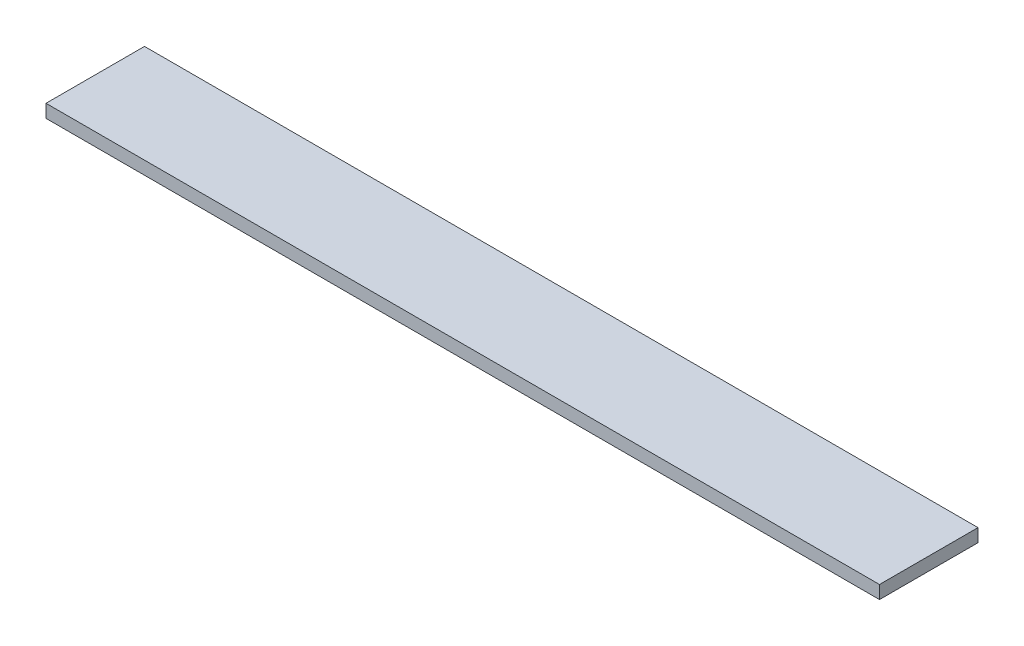
from build123d import *

# Parameters (mm, degrees)
SKETCH1_W           = 1083
SKETCH1_H           = 128
BOSS_EXTRUDE1_DEPTH = 17


with BuildPart() as part:
    # Sketch1 → Boss-Extrude1 (new body)
    with BuildSketch(Plane(origin=(0, 0, 0), x_dir=(1, 0, 0), z_dir=(0, 1, 0))):
        Rectangle(SKETCH1_W, SKETCH1_H)
    extrude(amount=BOSS_EXTRUDE1_DEPTH)


solid = part.part
